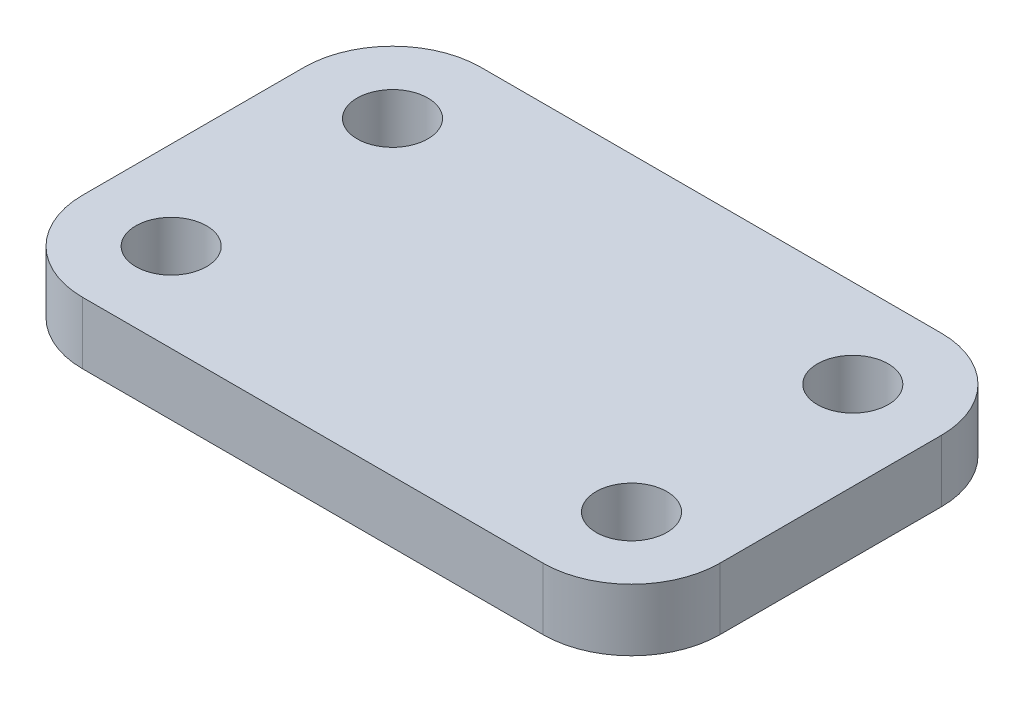
from build123d import *

# Parameters (mm, degrees)
CROQUIS1_R              = 4
SALIENTE_EXTRUIR5_DEPTH = 7


with BuildPart() as part:
    # Croquis1 → Saliente-Extruir5 (new body)
    with BuildSketch(Plane(origin=(0, 0, 0), x_dir=(1, 0, 0), z_dir=(0, 1, 0))):
        with BuildLine():
            Line((-35.065868263, 31.763420621), (16.934131737, 31.763420621))
            ThreePointArc((16.934131737, 31.763420621), (24.005199548, 28.834488433), (26.934131737, 21.763420621))
            Line((26.934131737, 21.763420621), (26.934131737, -3.236579379))
            ThreePointArc((26.934131737, -3.236579379), (24.005199548, -10.307647191), (16.934131737, -13.236579379))
            Line((16.934131737, -13.236579379), (-35.065868263, -13.236579379))
            ThreePointArc((-35.065868263, -13.236579379), (-42.136936075, -10.307647191), (-45.065868263, -3.236579379))
            Line((-45.065868263, -3.236579379), (-45.065868263, 21.763420621))
            ThreePointArc((-45.065868263, 21.763420621), (-42.136936075, 28.834488433), (-35.065868263, 31.763420621))
        make_face()
        with Locations(Location((-35.065868263, 21.763420621, 0), (0, 0, 270))):
            Circle(CROQUIS1_R, mode=Mode.SUBTRACT)
        with Locations(Location((-35.065868263, -3.236579379, 0), (0, 0, 270))):
            Circle(CROQUIS1_R, mode=Mode.SUBTRACT)
        with Locations(Location((16.934131737, 21.763420621, 0), (0, 0, 270))):
            Circle(CROQUIS1_R, mode=Mode.SUBTRACT)
        with Locations(Location((16.934131737, -3.236579379, 0), (0, 0, 270))):
            Circle(CROQUIS1_R, mode=Mode.SUBTRACT)
    extrude(amount=SALIENTE_EXTRUIR5_DEPTH)


solid = part.part
